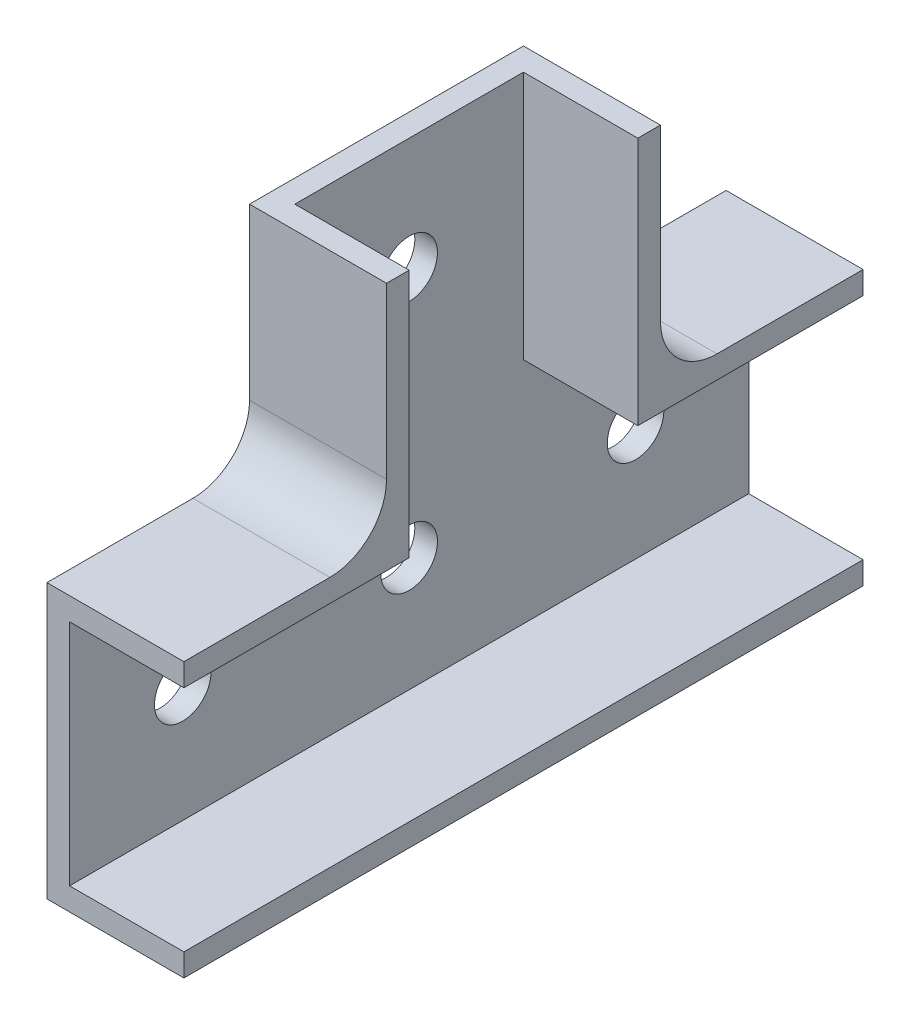
from build123d import *

# Parameters (mm, degrees)
SKETCH_2_W          = 24.2
SKETCH_2_H          = 24.2
SKETCH_2_W_2        = 20.2
SKETCH_2_H_2        = 20.2
EXTRUDE_4_DEPTH     = 100
SKETCH_6_W          = 24.2
SKETCH_6_H          = 24.2
SKETCH_6_W_2        = 20.2
SKETCH_6_H_2        = 20.2
EXTRUDE_5_DEPTH     = 40
SKETCH_7_R          = 2.5
CUT_EXTRUDE_1_DEPTH = 40
SKETCH_8_R          = 2.5
CUT_EXTRUDE_2_DEPTH = 40
CUT_EXTRUDE_START   = -40
SKETCH_9_W          = 20
SKETCH_9_H          = 24.2
SKETCH_9_R          = 2.5
CUT_EXTRUDE_3_DEPTH = 40
SKETCH_10_W         = 24.2
SKETCH_10_H         = 20
SKETCH_10_R         = 2.5
CUT_EXTRUDE_4_DEPTH = 40
SKETCH_11_W         = 69.821202151
SKETCH_11_H         = 48.665955669
CUT_EXTRUDE_5_DEPTH = 12.1
SKETCH_12_W         = 20.2
SKETCH_12_H         = 2
CUT_EXTRUDE_6_DEPTH = 10
SKETCH_13_W         = 20.2
SKETCH_13_H         = 2
CUT_EXTRUDE_7_DEPTH = 0.1
FILLET_1_R          = 5
FILLET_2_R          = 5


with BuildPart() as part:
    # 草图2 → 凸台-拉伸4 (new body)
    with BuildSketch(Plane.XY):
        Rectangle(SKETCH_2_W, SKETCH_2_H)
        Rectangle(SKETCH_2_W_2, SKETCH_2_H_2, mode=Mode.SUBTRACT)
    extrude(amount=EXTRUDE_4_DEPTH)

    # 草图6 → 凸台-拉伸5 (add)
    with BuildSketch(Plane(origin=(0, 12.1, 0), x_dir=(1, 0, 0), z_dir=(0, 1, 0))):
        with Locations((0, -50)):
            Rectangle(SKETCH_6_W, SKETCH_6_H)
        with Locations((0, -50)):
            Rectangle(SKETCH_6_W_2, SKETCH_6_H_2, mode=Mode.SUBTRACT)
    extrude(amount=EXTRUDE_5_DEPTH)

    # 草图7 → 切除-拉伸1 (cut)
    with BuildSketch(Plane.ZY.offset(12.1)):
        with Locations((10, 0)):
            Circle(SKETCH_7_R)
        with Locations((30, 0)):
            Circle(SKETCH_7_R)
        with Locations(Location((90, 0, 0), (0, 0, 180))):
            Circle(SKETCH_7_R)
        with Locations(Location((70, 0, 0), (0, 0, 180))):
            Circle(SKETCH_7_R)
        with Locations((50, 42.1)):
            Circle(SKETCH_7_R)
        with Locations((50, 22.1)):
            Circle(SKETCH_7_R)
    extrude(amount=-CUT_EXTRUDE_1_DEPTH, mode=Mode.SUBTRACT)

    # 草图8 → 切除-拉伸2 (cut)
    with BuildSketch(Plane(origin=(12.1, 0, 0), x_dir=(0, 0, -1), z_dir=(1, 0, 0))):
        with Locations((-50, 0)):
            Circle(SKETCH_8_R)
    extrude(amount=-CUT_EXTRUDE_2_DEPTH, mode=Mode.SUBTRACT)

    # 草图9 → 切除-拉伸3 (cut)
    # profile 1 of 2: a face of its own
    with BuildSketch(Plane(origin=(12.1, 0, 0), x_dir=(0, 0, -1), z_dir=(1, 0, 0)).offset(CUT_EXTRUDE_START)):
        with Locations((-10, 0)):
            Rectangle(SKETCH_9_W, SKETCH_9_H)
        with Locations((-10, 0)):
            Circle(SKETCH_9_R, mode=Mode.SUBTRACT)
    # profile 2 of 2: a face of its own
    with BuildSketch(Plane(origin=(12.1, 0, 0), x_dir=(0, 0, -1), z_dir=(1, 0, 0)).offset(CUT_EXTRUDE_START)):
        with Locations((-90, 0)):
            Rectangle(SKETCH_9_W, SKETCH_9_H)
        with Locations((-90, 0)):
            Circle(SKETCH_9_R, mode=Mode.SUBTRACT)
    extrude(amount=CUT_EXTRUDE_3_DEPTH, mode=Mode.SUBTRACT)

    # 草图10 → 切除-拉伸4 (cut)
    with BuildSketch(Plane(origin=(12.1, 0, 0), x_dir=(0, 0, -1), z_dir=(1, 0, 0)).offset(CUT_EXTRUDE_START)):
        with Locations((-50, 42.1)):
            Rectangle(SKETCH_10_W, SKETCH_10_H)
        with Locations((-50, 42.1)):
            Circle(SKETCH_10_R, mode=Mode.SUBTRACT)
    extrude(amount=CUT_EXTRUDE_4_DEPTH, mode=Mode.SUBTRACT)

    # 草图11 → 切除-拉伸5 (cut)
    with BuildSketch(Plane(origin=(12.1, 0, 0), x_dir=(0, 0, -1), z_dir=(1, 0, 0))):
        with Locations((-50.999985391, 8.600020454)):
            Rectangle(SKETCH_11_W, SKETCH_11_H)
    extrude(amount=-CUT_EXTRUDE_5_DEPTH, mode=Mode.SUBTRACT)

    # 草图12 → 切除-拉伸6 (cut)
    with BuildSketch(Plane(origin=(0, 0, 0), x_dir=(0, 0, -1), z_dir=(1, 0, 0))):
        with Locations((-50, 11.1)):
            Rectangle(SKETCH_12_W, SKETCH_12_H)
    extrude(amount=-CUT_EXTRUDE_6_DEPTH, mode=Mode.SUBTRACT)

    # 草图13 → 切除-拉伸7 (cut)
    with BuildSketch(Plane(origin=(-10, 0, 0), x_dir=(0, 0, -1), z_dir=(1, 0, 0))):
        with Locations((-50, 11.1)):
            Rectangle(SKETCH_13_W, SKETCH_13_H)
    extrude(amount=-CUT_EXTRUDE_7_DEPTH, mode=Mode.SUBTRACT)

    # 圆角1
    fillet_1_edges = [part.edges().sort_by_distance(p)[0] for p in [
        (-6.05, 12.1, 37.9),
    ]]
    fillet(fillet_1_edges, radius=FILLET_1_R)

    # 圆角2
    fillet_2_edges = [part.edges().sort_by_distance(p)[0] for p in [
        (-6.05, 12.1, 62.1),
    ]]
    fillet(fillet_2_edges, radius=FILLET_2_R)


solid = part.part
